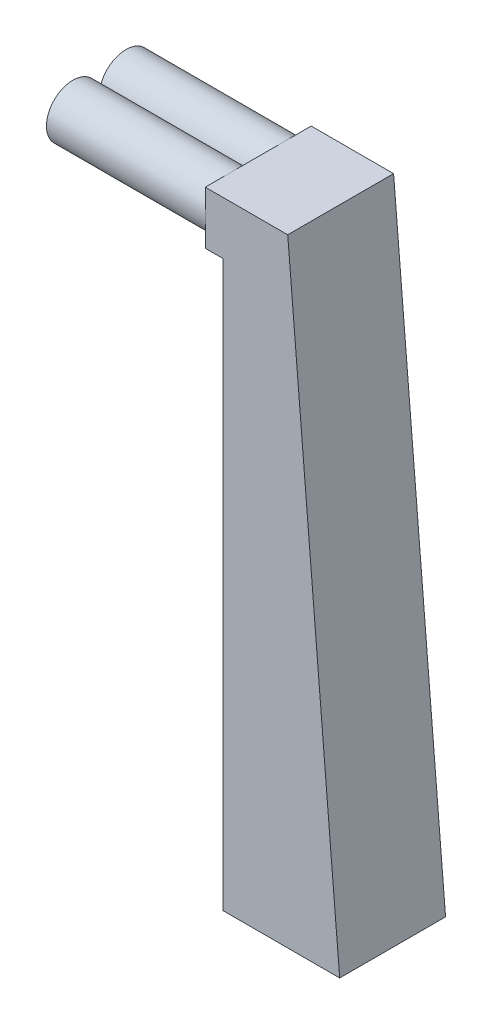
from build123d import *

# Parameters (mm, degrees)
ESTRUSIONE_ESTRUSIONE1_DEPTH      = 30
ESTRUSIONE_ESTRUSIONE1_DEPTH_BACK = 30
ESTRUSIONE_ESTRUSIONE2_DEPTH      = 100
SCHIZZO4_W                        = 60
SCHIZZO4_H                        = 30
ESTRUSIONE_ESTRUSIONE3_DEPTH      = 10


with BuildPart() as part:
    # Schizzo2 → Estrusione-Estrusione1 (new, two sides: drawn at the far end of the back side and taken through both)
    with BuildSketch(Plane.XY.offset(-ESTRUSIONE_ESTRUSIONE1_DEPTH_BACK)):
        Polygon((-15.384222889, 0), (50.78379402, 0), (21.335941259, 350), (-15.384222889, 350), align=None)
    extrude(amount=ESTRUSIONE_ESTRUSIONE1_DEPTH + ESTRUSIONE_ESTRUSIONE1_DEPTH_BACK)

    # Schizzo3 → Estrusione-Estrusione2 (add)
    with BuildSketch(Plane.ZY.offset(15.384222889)):
        with BuildLine():
            Line((-0.032724291, 335.990281697), (0.032724291, 335.990281697))
            ThreePointArc((0.032724291, 335.990281697), (29.999935115, 334.955880248), (0.027157826, 334.097782056))
            Line((0.027157826, 334.097782056), (-0.027157826, 334.097782056))
            ThreePointArc((-0.027157826, 334.097782056), (-29.999935115, 334.955880248), (-0.032724291, 335.990281697))
        make_face()
    extrude(amount=ESTRUSIONE_ESTRUSIONE2_DEPTH)

    # Schizzo4 → Estrusione-Estrusione3 (add)
    with BuildSketch(Plane.ZY.offset(15.384222889)):
        with Locations((0, 335)):
            Rectangle(SCHIZZO4_W, SCHIZZO4_H)
    extrude(amount=ESTRUSIONE_ESTRUSIONE3_DEPTH)


solid = part.part
